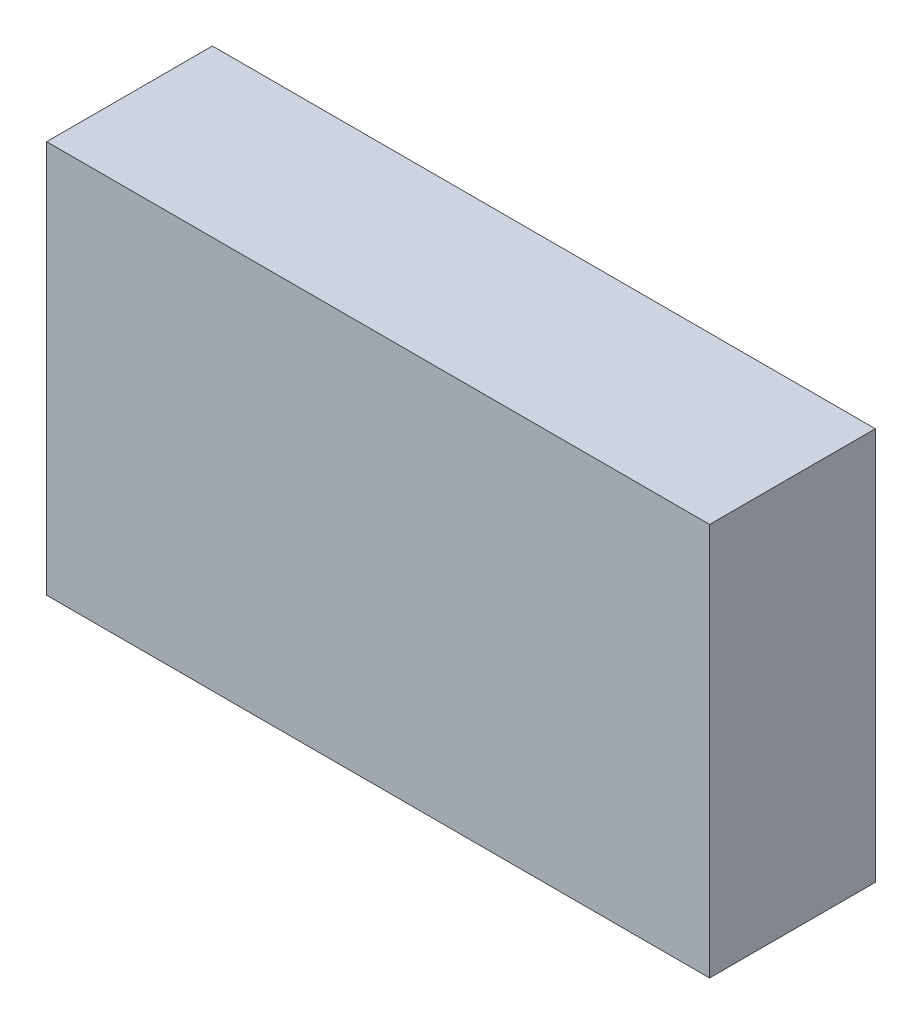
from build123d import *

# Parameters (mm, degrees)
SKETCH1_W           = 40
SKETCH1_H           = 23.7
BOSS_EXTRUDE1_DEPTH = 10


with BuildPart() as part:
    # Sketch1 → Boss-Extrude1 (new body)
    with BuildSketch(Plane.XY):
        with Locations((20, 11.85)):
            Rectangle(SKETCH1_W, SKETCH1_H)
    extrude(amount=-BOSS_EXTRUDE1_DEPTH)


solid = part.part
